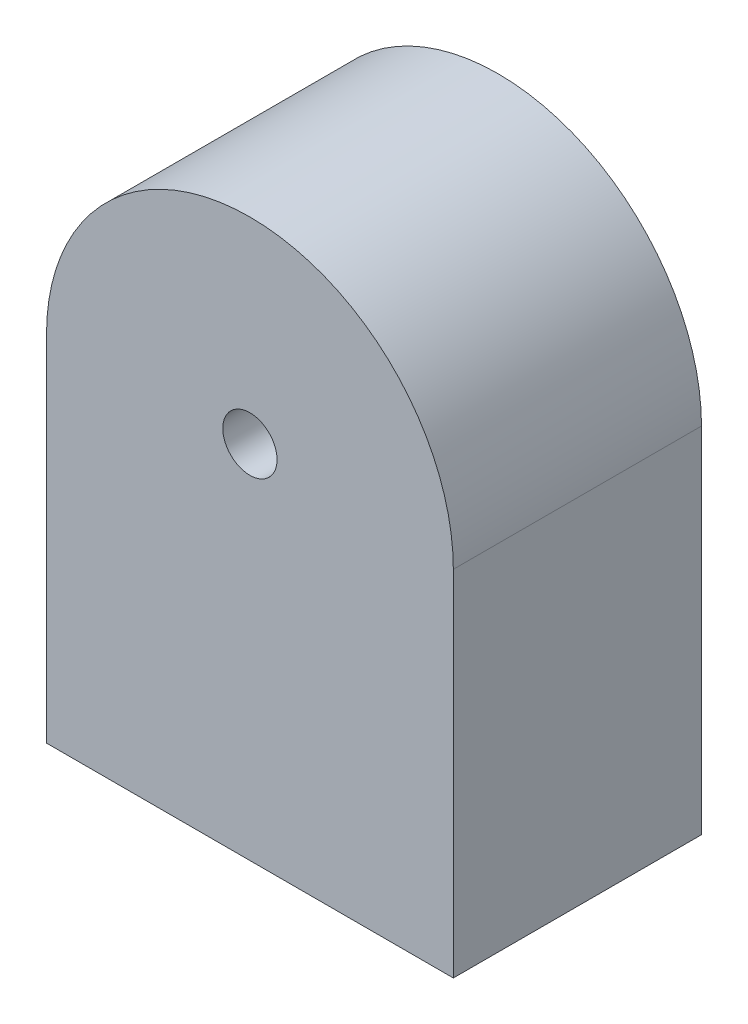
from build123d import *

# Parameters (mm, degrees)
EXTRUSION1_DEPTH = 18.3
ESQUISSE2_R      = 2
EXTRUSION2_DEPTH = 6.3


with BuildPart() as part:
    # Esquisse1 → Extrusion1 (new body)
    with BuildSketch(Plane.XY):
        with BuildLine():
            Line((0, 0), (30, 0))
            Line((30, 0), (30, 26.1))
            ThreePointArc((30, 26.1), (15, 41.1), (0, 26.1))
            Line((0, 26.1), (0, 0))
        make_face()
    extrude(amount=-EXTRUSION1_DEPTH)

    # Esquisse2 → Extrusion2 (cut)
    with BuildSketch(Plane.XY):
        with Locations((15, 26.6)):
            Circle(ESQUISSE2_R)
    extrude(amount=-EXTRUSION2_DEPTH, mode=Mode.SUBTRACT)


solid = part.part
